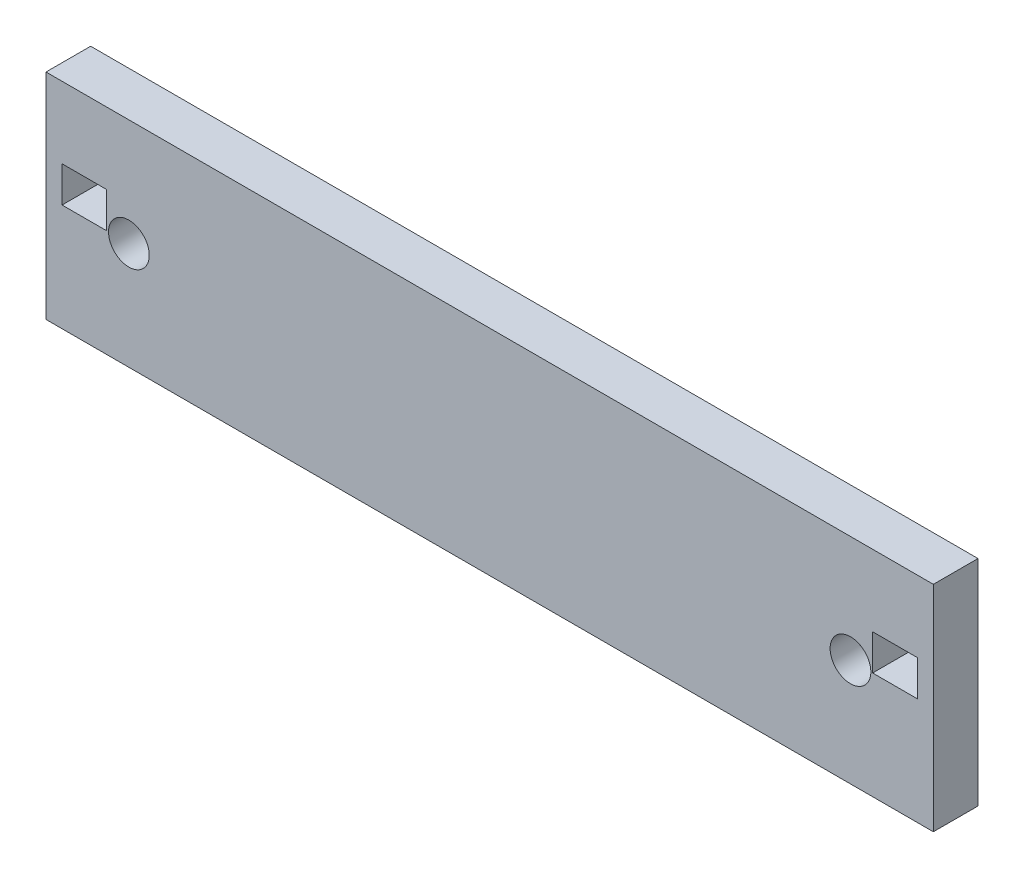
from build123d import *

# Parameters (mm, degrees)
SKETCH1_W           = 31.5468
SKETCH1_H           = 7.62
SKETCH1_R           = 0.7239
SKETCH1_W_2         = 1.5875
SKETCH1_H_2         = 1.27
BOSS_EXTRUDE1_DEPTH = 1.5875


with BuildPart() as part:
    # Sketch1 → Boss-Extrude1 (new body)
    with BuildSketch(Plane.XY):
        with Locations((-2.2606, 0)):
            Rectangle(SKETCH1_W, SKETCH1_H)
        with Locations((-15.0876, 0)):
            Circle(SKETCH1_R, mode=Mode.SUBTRACT)
        with Locations(Location((10.5664, 0, 0), (0, 0, 180))):
            Circle(SKETCH1_R, mode=Mode.SUBTRACT)
        with Locations((-16.66875, 0.635)):
            Rectangle(SKETCH1_W_2, SKETCH1_H_2, mode=Mode.SUBTRACT)
        with Locations((12.14755, 0.635)):
            Rectangle(SKETCH1_W_2, SKETCH1_H_2, mode=Mode.SUBTRACT)
    extrude(amount=BOSS_EXTRUDE1_DEPTH)


solid = part.part
